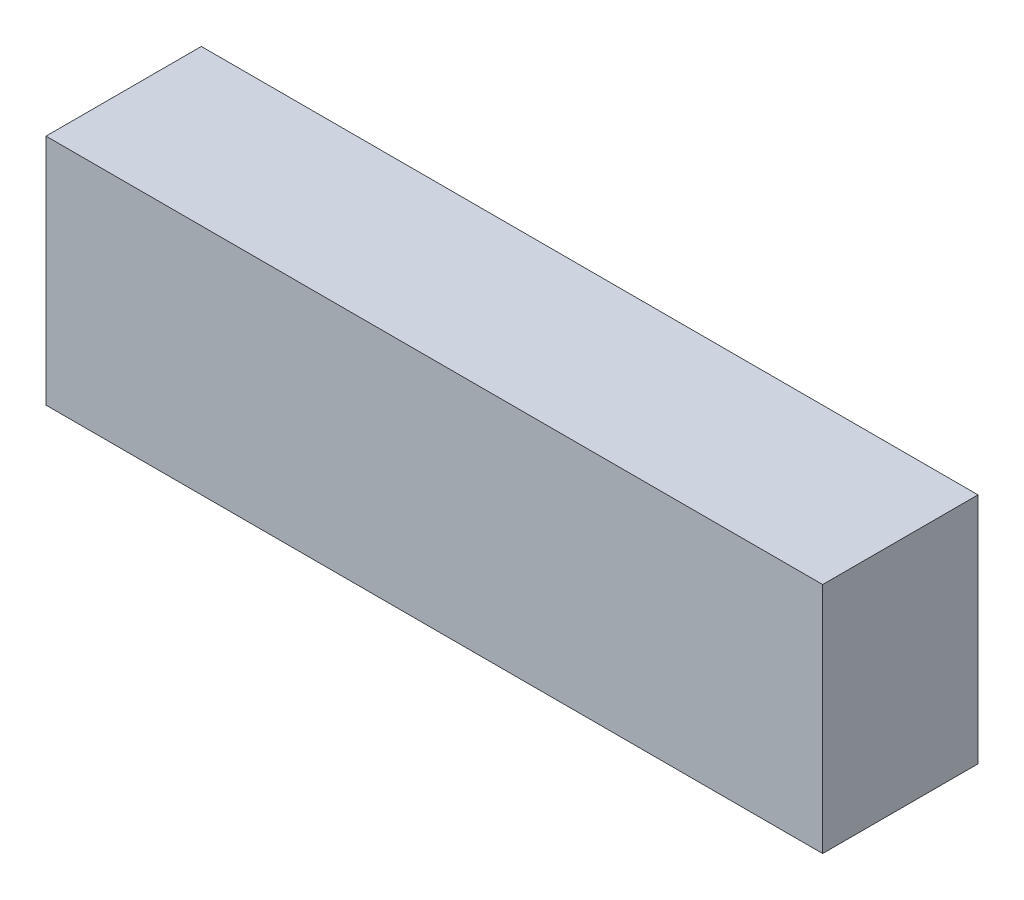
from build123d import *

# Parameters (mm, degrees)
CROQUIS1_W              = 254
CROQUIS1_H              = 76.2
SALIENTE_EXTRUIR1_DEPTH = 50.8


with BuildPart() as part:
    # Croquis1 → Saliente-Extruir1 (new body)
    with BuildSketch(Plane.XY):
        Rectangle(CROQUIS1_W, CROQUIS1_H)
    extrude(amount=SALIENTE_EXTRUIR1_DEPTH)


solid = part.part
